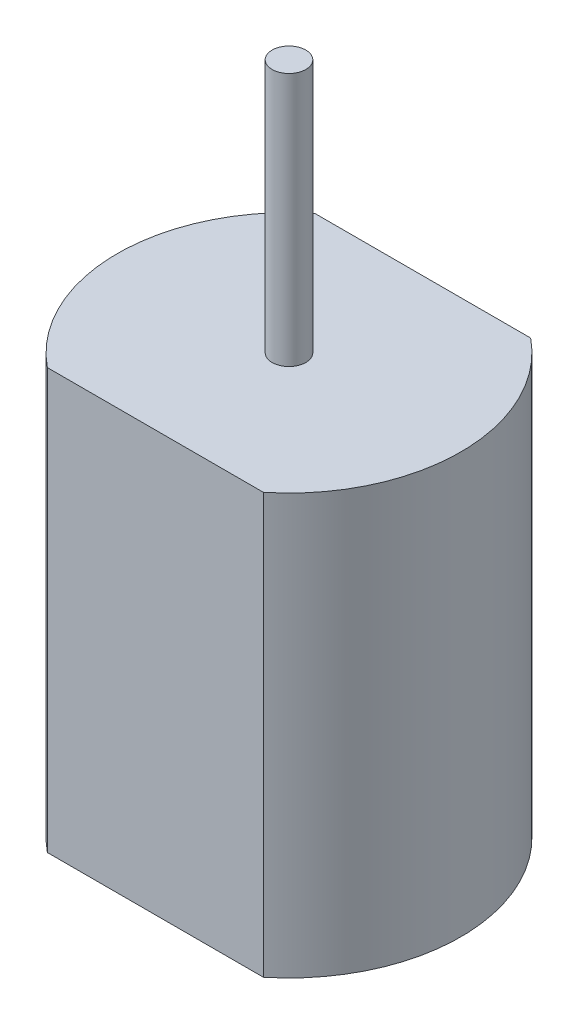
from build123d import *

# Parameters (mm, degrees)
EXTRUDE_1_DEPTH = 18.7
SKETCH_2_R      = 0.75
EXTRUDE_2_DEPTH = 11.3


with BuildPart() as part:
    # 草图1 → 凸台-拉伸1 (new body)
    with BuildSketch(Plane(origin=(0, 0, 0), x_dir=(1, 0, 0), z_dir=(0, 1, 0))):
        with BuildLine():
            Line((4.808326112, 5.95), (-4.808326112, 5.95))
            ThreePointArc((-4.808326112, 5.95), (-7.65, 0), (-4.808326112, -5.95))
            Line((-4.808326112, -5.95), (4.808326112, -5.95))
            ThreePointArc((4.808326112, -5.95), (7.65, 0), (4.808326112, 5.95))
        make_face()
    extrude(amount=EXTRUDE_1_DEPTH)

    # 草图2 → 凸台-拉伸2 (add)
    with BuildSketch(Plane(origin=(0, 18.7, 0), x_dir=(1, 0, 0), z_dir=(0, 1, 0))):
        with Locations(Location((0, 0, 0), (0, 0, 270))):
            Circle(SKETCH_2_R)
    extrude(amount=EXTRUDE_2_DEPTH)


solid = part.part
